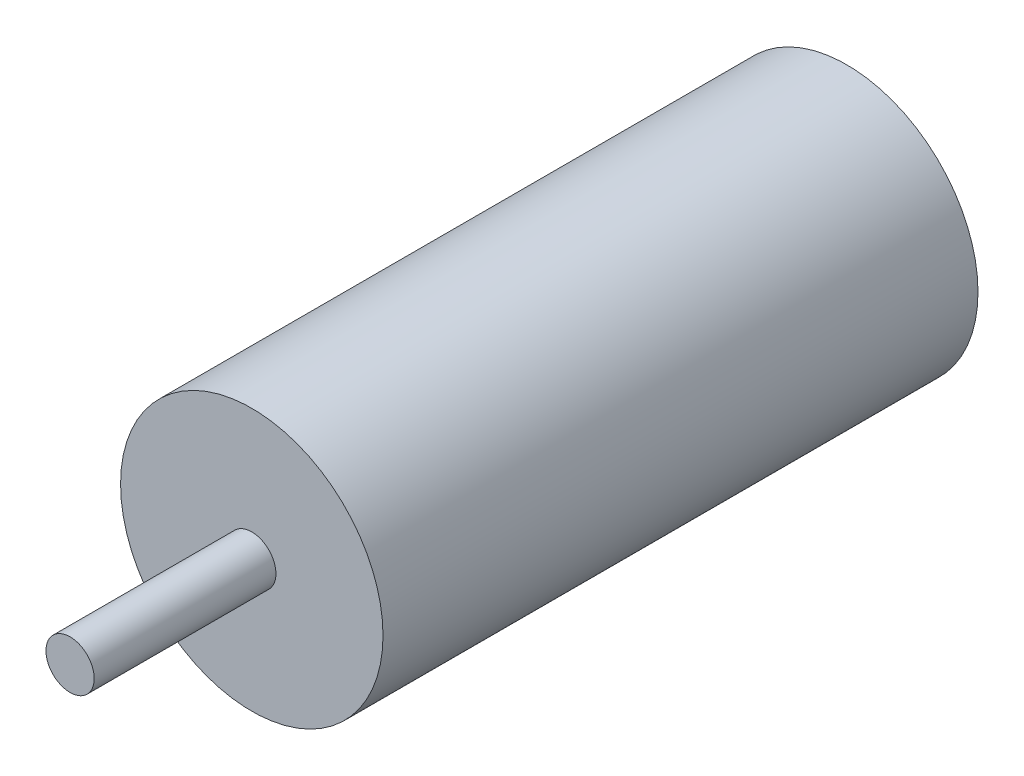
from build123d import *

# Parameters (mm, degrees)
SKETCH1_R           = 11.049
BOSS_EXTRUDE1_DEPTH = 50.099982096
SKETCH2_R           = 2.032
BOSS_EXTRUDE2_DEPTH = 15.300096908


with BuildPart() as part:
    # Sketch1 → Boss-Extrude1 (new body)
    with BuildSketch(Plane.XY):
        Circle(SKETCH1_R)
    extrude(amount=BOSS_EXTRUDE1_DEPTH)

    # Sketch2 → Boss-Extrude2 (add)
    with BuildSketch(Plane.XY.offset(50.099982096)):
        Circle(SKETCH2_R)
    extrude(amount=BOSS_EXTRUDE2_DEPTH)


solid = part.part
